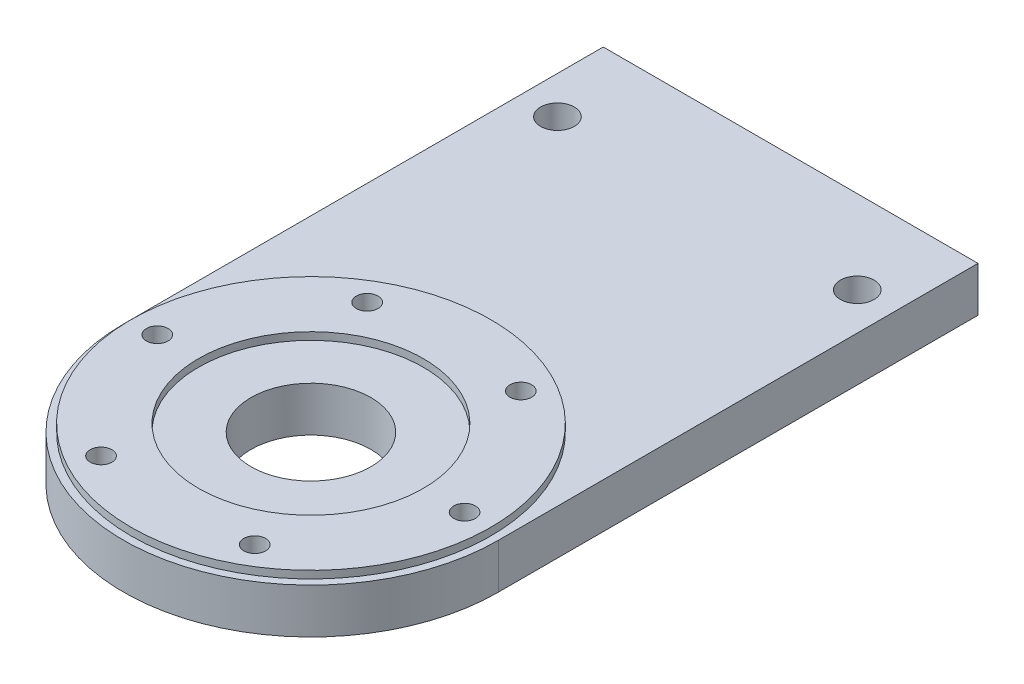
from build123d import *

# Parameters (mm, degrees)
PARED_START                    = -27.5
SK_PARED_W                     = 50
SK_PARED_H                     = 64
PARED_DEPTH                    = 6
CABEZA_START                   = -27.5
SK_CABEZA_R                    = 25
CABEZA_DEPTH                   = 6
ASIENTO_1MM_START              = -21.5
SK_ASIENTO_1MM_R               = 24
SK_ASIENTO_1MM_R_2             = 15
ASIENTO_1MM_DEPTH              = 1
PASO_CENTRAL_START             = -27.5
SK_PASO_CENTRAL_R              = 8
PASO_CENTRAL_DEPTH             = 7
PASANTES_M2_5_ESTATOR_J5_START = -27.5
SK_PASANTES_M2_5_ESTATOR_J5_R  = 1.45
PASANTES_M2_5_ESTATOR_J5_DEPTH = 7
CAJAS_M2_5_J5_START            = -27.5
SK_CAJAS_M2_5_J5_R             = 2.75
CAJAS_M2_5_J5_DEPTH            = 2.5
PASANTES_M4_ANGULOS_START      = -27.5
SK_PASANTES_M4_ANGULOS_R       = 2.25
PASANTES_M4_ANGULOS_DEPTH      = 6


with BuildPart() as part:
    # Sk_Pared → Pared (new body)
    with BuildSketch(Plane(origin=(0, 0, 0), x_dir=(1, 0, 0), z_dir=(0, 1, 0)).offset(PARED_START)):
        with Locations((0, -458)):
            Rectangle(SK_PARED_W, SK_PARED_H)
    extrude(amount=PARED_DEPTH)

    # Sk_Cabeza → Cabeza (add)
    with BuildSketch(Plane(origin=(0, 0, 0), x_dir=(1, 0, 0), z_dir=(0, 1, 0)).offset(CABEZA_START)):
        with Locations((0, -490)):
            Circle(SK_CABEZA_R)
    extrude(amount=CABEZA_DEPTH)

    # Sk_Asiento_1mm → Asiento_1mm (add)
    with BuildSketch(Plane(origin=(0, 0, 0), x_dir=(1, 0, 0), z_dir=(0, 1, 0)).offset(ASIENTO_1MM_START)):
        with Locations(Location((0, -490, 0), (0, 0, 270))):
            Circle(SK_ASIENTO_1MM_R)
        with Locations(Location((0, -490, 0), (0, 0, 270))):
            Circle(SK_ASIENTO_1MM_R_2, mode=Mode.SUBTRACT)
    extrude(amount=ASIENTO_1MM_DEPTH)

    # Sk_Paso_central → Paso_central (cut)
    with BuildSketch(Plane(origin=(0, 0, 0), x_dir=(1, 0, 0), z_dir=(0, 1, 0)).offset(PASO_CENTRAL_START)):
        with Locations(Location((0, -490, 0), (0, 0, 90))):
            Circle(SK_PASO_CENTRAL_R)
    extrude(amount=PASO_CENTRAL_DEPTH, mode=Mode.SUBTRACT)

    # Sk_Pasantes_M2-5_estator_J5 → Pasantes_M2-5_estator_J5 (cut)
    with BuildSketch(Plane(origin=(0, 0, 0), x_dir=(1, 0, 0), z_dir=(0, 1, 0)).offset(PASANTES_M2_5_ESTATOR_J5_START)):
        with Locations(Location((20.5, -490, 0), (0, 0, 270))):
            Circle(SK_PASANTES_M2_5_ESTATOR_J5_R)
        with Locations(Location((10.25, -507.753520778, 0), (0, 0, 270))):
            Circle(SK_PASANTES_M2_5_ESTATOR_J5_R)
        with Locations(Location((-10.25, -507.753520778, 0), (0, 0, 270))):
            Circle(SK_PASANTES_M2_5_ESTATOR_J5_R)
        with Locations(Location((-20.5, -490, 0), (0, 0, 270))):
            Circle(SK_PASANTES_M2_5_ESTATOR_J5_R)
        with Locations(Location((-10.25, -472.246479222, 0), (0, 0, 270))):
            Circle(SK_PASANTES_M2_5_ESTATOR_J5_R)
        with Locations(Location((10.25, -472.246479222, 0), (0, 0, 270))):
            Circle(SK_PASANTES_M2_5_ESTATOR_J5_R)
    extrude(amount=PASANTES_M2_5_ESTATOR_J5_DEPTH, mode=Mode.SUBTRACT)

    # Sk_Cajas_M2-5_J5 → Cajas_M2-5_J5 (cut)
    with BuildSketch(Plane(origin=(0, 0, 0), x_dir=(1, 0, 0), z_dir=(0, 1, 0)).offset(CAJAS_M2_5_J5_START)):
        with Locations(Location((10.25, -507.753520778, 0), (0, 0, 270))):
            Circle(SK_CAJAS_M2_5_J5_R)
        with Locations(Location((-10.25, -507.753520778, 0), (0, 0, 270))):
            Circle(SK_CAJAS_M2_5_J5_R)
        with Locations(Location((-10.25, -472.246479222, 0), (0, 0, 270))):
            Circle(SK_CAJAS_M2_5_J5_R)
        with Locations(Location((10.25, -472.246479222, 0), (0, 0, 270))):
            Circle(SK_CAJAS_M2_5_J5_R)
    extrude(amount=CAJAS_M2_5_J5_DEPTH, mode=Mode.SUBTRACT)

    # Sk_Pasantes_M4_angulos → Pasantes_M4_angulos (cut)
    with BuildSketch(Plane(origin=(0, 0, 0), x_dir=(1, 0, 0), z_dir=(0, 1, 0)).offset(PASANTES_M4_ANGULOS_START)):
        with Locations(Location((-20, -437.11, 0), (0, 0, 270))):
            Circle(SK_PASANTES_M4_ANGULOS_R)
        with Locations(Location((20, -437.11, 0), (0, 0, 270))):
            Circle(SK_PASANTES_M4_ANGULOS_R)
    extrude(amount=PASANTES_M4_ANGULOS_DEPTH, mode=Mode.SUBTRACT)


solid = part.part
